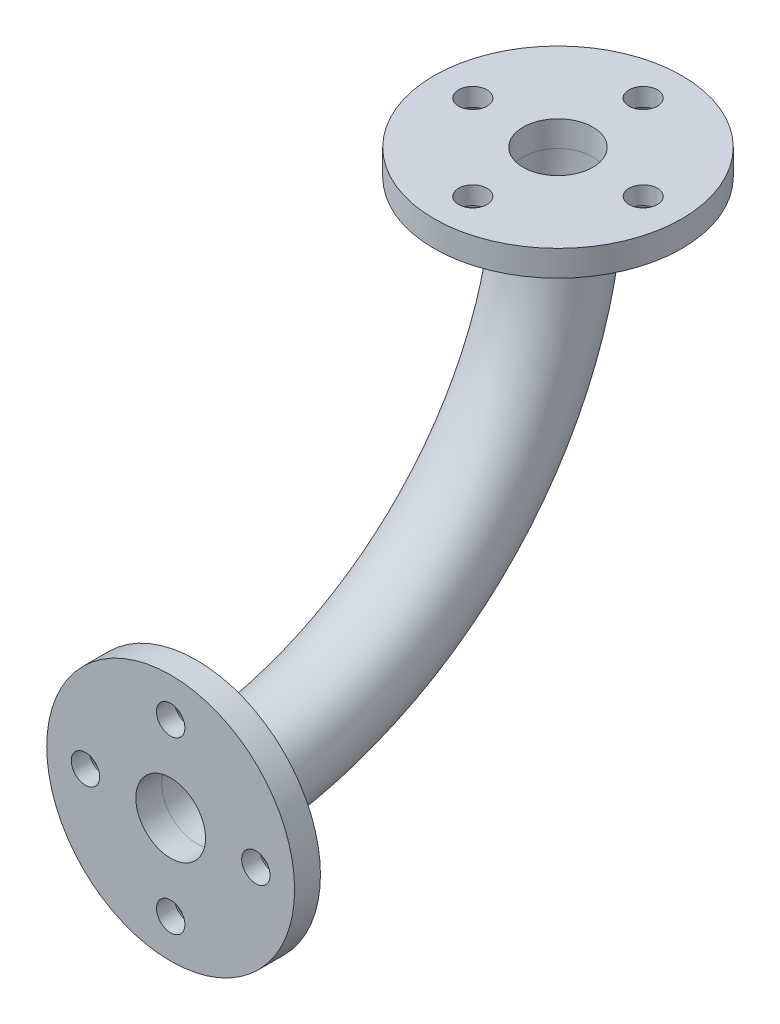
from build123d import *

# Parameters (mm, degrees)
CROQUIS1_R              = 48
CROQUIS1_R_2            = 13.5
SALIENTE_EXTRUIR1_DEPTH = 10
CROQUIS2_R              = 18
CROQUIS2_R_2            = 13.5
TALADRO1_D              = 11
TALADRO1_DEPTH          = 10
TALADRO1_CBORE_D        = 18
TALADRO1_CBORE_DEPTH    = 3
TALADRO1_TIP            = 3.304733405
CROQUIS8_R              = 48
CROQUIS8_R_2            = 13.5
SALIENTE_EXTRUIR3_DEPTH = 10
TALADRO2_D              = 11
TALADRO2_DEPTH          = 10
TALADRO2_CBORE_D        = 18
TALADRO2_CBORE_DEPTH    = 3
TALADRO2_TIP            = 3.304733405


with BuildPart() as part:
    # Croquis1 → Saliente-Extruir1 (new body)
    with BuildSketch(Plane.XY):
        Circle(CROQUIS1_R)
        Circle(CROQUIS1_R_2, mode=Mode.SUBTRACT)
    extrude(amount=-SALIENTE_EXTRUIR1_DEPTH)

    # Barrer1: sweep along a path in Croquis3
    with BuildLine(Plane(origin=(0, 0, 0), x_dir=(0, 0, -1), z_dir=(1, 0, 0))) as barrer1_path:
        ThreePointArc((10, 0), (108.994949366, 41.005050634), (150, 140))
    # Croquis2 → Barrer1 (sweep)
    with BuildSketch(Plane(origin=(0, 0, -10), x_dir=(-1, 0, 0), z_dir=(0, 0, -1))):
        Circle(CROQUIS2_R)
        Circle(CROQUIS2_R_2, mode=Mode.SUBTRACT)
    sweep(path=barrer1_path.line)

    # Taladro1
    with Locations(Plane(origin=(0, 0, -10), x_dir=(-1, 0, 0), z_dir=(0, 0, -1))):
        with Locations((0, 33), (33, 0), (0, -33), (-33, 0)):
            CounterBoreHole(TALADRO1_D / 2, TALADRO1_CBORE_D / 2, TALADRO1_CBORE_DEPTH, depth=TALADRO1_DEPTH)
            with Locations((0, 0, -(TALADRO1_DEPTH + TALADRO1_TIP / 2))):  # 118° drill point
                Cone(0, TALADRO1_D / 2, TALADRO1_TIP, mode=Mode.SUBTRACT)

    # Croquis8 → Saliente-Extruir3 (add)
    with BuildSketch(Plane(origin=(0, 140, 0), x_dir=(1, 0, 0), z_dir=(0, 1, 0))):
        with Locations(Location((0, 150, 0), (0, 0, 270))):
            Circle(CROQUIS8_R)
        with Locations(Location((0, 150, 0), (0, 0, 90))):
            Circle(CROQUIS8_R_2, mode=Mode.SUBTRACT)
    extrude(amount=SALIENTE_EXTRUIR3_DEPTH)

    # Taladro2
    with Locations(Plane(origin=(0, 140, 0), x_dir=(-1, 0, 0), z_dir=(0, -1, 0))):
        with Locations((0, 117), (33, 150), (0, 183), (-33, 150)):
            CounterBoreHole(TALADRO2_D / 2, TALADRO2_CBORE_D / 2, TALADRO2_CBORE_DEPTH, depth=TALADRO2_DEPTH)
            with Locations((0, 0, -(TALADRO2_DEPTH + TALADRO2_TIP / 2))):  # 118° drill point
                Cone(0, TALADRO2_D / 2, TALADRO2_TIP, mode=Mode.SUBTRACT)


solid = part.part
